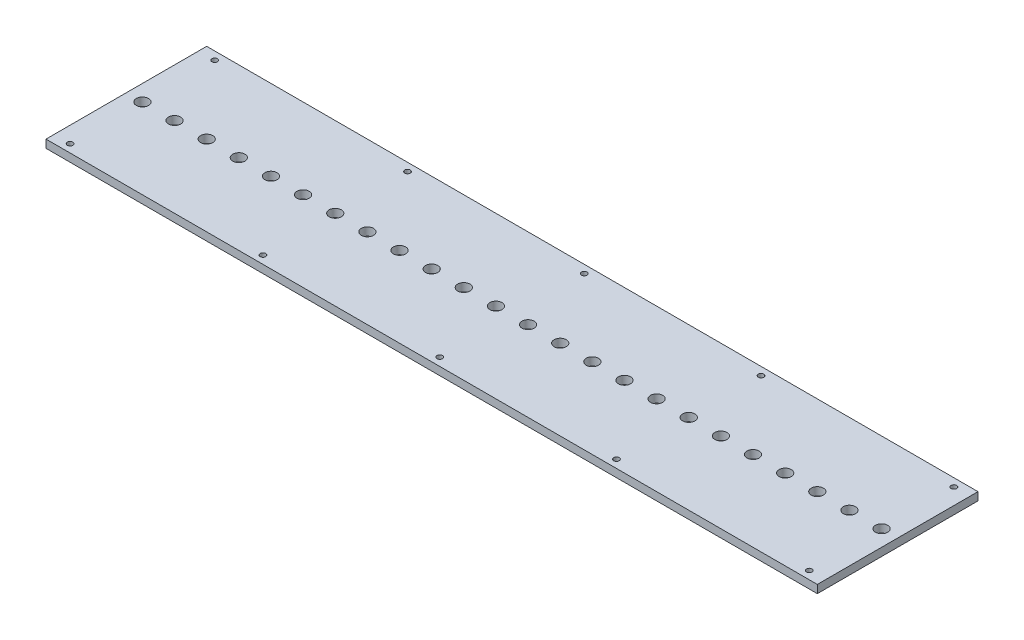
from build123d import *

# Parameters (mm, degrees)
SKETCH2_W           = 609.6
SKETCH2_H           = 127
SKETCH2_R           = 4.826
BOSS_EXTRUDE1_DEPTH = 6.35
SKETCH3_R           = 2.1828125
CUT_EXTRUDE1_DEPTH  = 6.35


with BuildPart() as part:
    # Sketch2 → Boss-Extrude1 (new body)
    with BuildSketch(Plane(origin=(0, 0, 0), x_dir=(1, 0, 0), z_dir=(0, 1, 0))):
        with Locations((304.8, 63.5)):
            Rectangle(SKETCH2_W, SKETCH2_H)
        with Locations(Location((12.7, 63.5, 0), (0, 0, 270))):
            Circle(SKETCH2_R, mode=Mode.SUBTRACT)
        with Locations(Location((38.1, 63.5, 0), (0, 0, 270))):
            Circle(SKETCH2_R, mode=Mode.SUBTRACT)
        with Locations(Location((63.5, 63.5, 0), (0, 0, 270))):
            Circle(SKETCH2_R, mode=Mode.SUBTRACT)
        with Locations(Location((88.9, 63.5, 0), (0, 0, 270))):
            Circle(SKETCH2_R, mode=Mode.SUBTRACT)
        with Locations(Location((114.3, 63.5, 0), (0, 0, 270))):
            Circle(SKETCH2_R, mode=Mode.SUBTRACT)
        with Locations(Location((139.7, 63.5, 0), (0, 0, 270))):
            Circle(SKETCH2_R, mode=Mode.SUBTRACT)
        with Locations(Location((165.1, 63.5, 0), (0, 0, 270))):
            Circle(SKETCH2_R, mode=Mode.SUBTRACT)
        with Locations(Location((190.5, 63.5, 0), (0, 0, 270))):
            Circle(SKETCH2_R, mode=Mode.SUBTRACT)
        with Locations(Location((215.9, 63.5, 0), (0, 0, 270))):
            Circle(SKETCH2_R, mode=Mode.SUBTRACT)
        with Locations(Location((241.3, 63.5, 0), (0, 0, 270))):
            Circle(SKETCH2_R, mode=Mode.SUBTRACT)
        with Locations(Location((266.7, 63.5, 0), (0, 0, 270))):
            Circle(SKETCH2_R, mode=Mode.SUBTRACT)
        with Locations(Location((292.1, 63.5, 0), (0, 0, 270))):
            Circle(SKETCH2_R, mode=Mode.SUBTRACT)
        with Locations(Location((317.5, 63.5, 0), (0, 0, 270))):
            Circle(SKETCH2_R, mode=Mode.SUBTRACT)
        with Locations(Location((342.9, 63.5, 0), (0, 0, 270))):
            Circle(SKETCH2_R, mode=Mode.SUBTRACT)
        with Locations(Location((368.3, 63.5, 0), (0, 0, 270))):
            Circle(SKETCH2_R, mode=Mode.SUBTRACT)
        with Locations(Location((393.7, 63.5, 0), (0, 0, 270))):
            Circle(SKETCH2_R, mode=Mode.SUBTRACT)
        with Locations(Location((419.1, 63.5, 0), (0, 0, 270))):
            Circle(SKETCH2_R, mode=Mode.SUBTRACT)
        with Locations(Location((444.5, 63.5, 0), (0, 0, 270))):
            Circle(SKETCH2_R, mode=Mode.SUBTRACT)
        with Locations(Location((469.9, 63.5, 0), (0, 0, 270))):
            Circle(SKETCH2_R, mode=Mode.SUBTRACT)
        with Locations(Location((495.3, 63.5, 0), (0, 0, 270))):
            Circle(SKETCH2_R, mode=Mode.SUBTRACT)
        with Locations(Location((520.7, 63.5, 0), (0, 0, 270))):
            Circle(SKETCH2_R, mode=Mode.SUBTRACT)
        with Locations(Location((546.1, 63.5, 0), (0, 0, 270))):
            Circle(SKETCH2_R, mode=Mode.SUBTRACT)
        with Locations(Location((571.5, 63.5, 0), (0, 0, 270))):
            Circle(SKETCH2_R, mode=Mode.SUBTRACT)
        with Locations(Location((596.9, 63.5, 0), (0, 0, 270))):
            Circle(SKETCH2_R, mode=Mode.SUBTRACT)
    extrude(amount=BOSS_EXTRUDE1_DEPTH)

    # Sketch3 → Cut-Extrude1 (cut)
    with BuildSketch(Plane(origin=(0, 6.35, 0), x_dir=(1, 0, 0), z_dir=(0, 1, 0))):
        with Locations(Location((12.7, 120.65, 0), (0, 0, 270))):
            Circle(SKETCH3_R)
        with Locations(Location((165.1, 120.65, 0), (0, 0, 270))):
            Circle(SKETCH3_R)
        with Locations(Location((304.8, 120.65, 0), (0, 0, 270))):
            Circle(SKETCH3_R)
        with Locations(Location((444.5, 120.65, 0), (0, 0, 270))):
            Circle(SKETCH3_R)
        with Locations(Location((596.9, 120.65, 0), (0, 0, 270))):
            Circle(SKETCH3_R)
        with Locations(Location((596.9, 6.35, 0), (0, 0, 270))):
            Circle(SKETCH3_R)
        with Locations(Location((444.5, 6.35, 0), (0, 0, 270))):
            Circle(SKETCH3_R)
        with Locations(Location((304.8, 6.35, 0), (0, 0, 270))):
            Circle(SKETCH3_R)
        with Locations(Location((165.1, 6.35, 0), (0, 0, 270))):
            Circle(SKETCH3_R)
        with Locations(Location((12.7, 6.35, 0), (0, 0, 270))):
            Circle(SKETCH3_R)
    extrude(amount=-CUT_EXTRUDE1_DEPTH, mode=Mode.SUBTRACT)


solid = part.part
